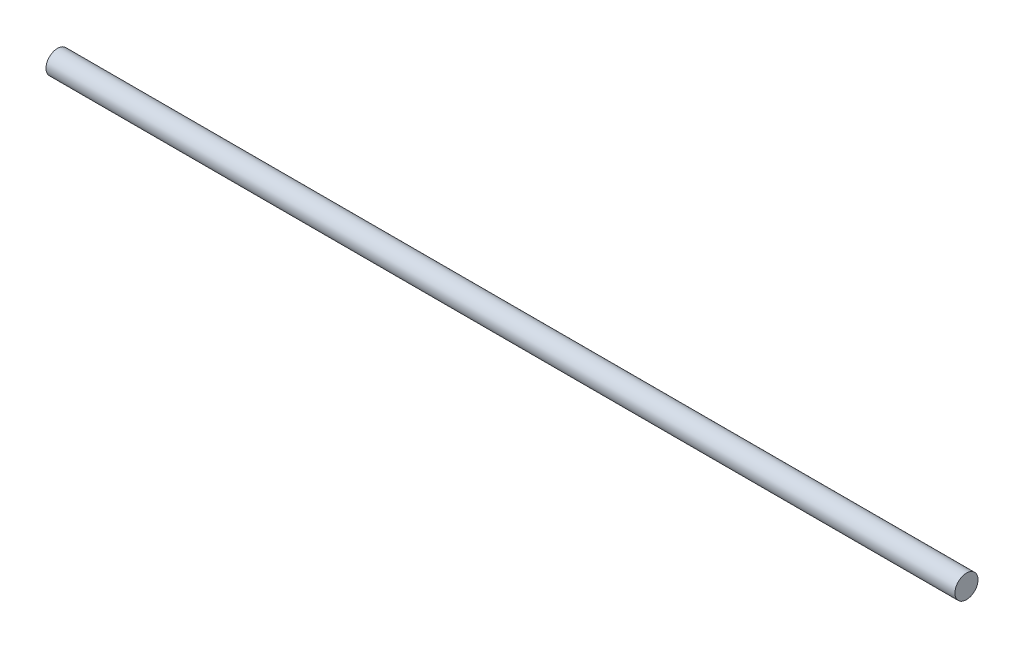
from build123d import *

# Parameters (mm, degrees)
SKETCH1_R           = 6.35
BOSS_EXTRUDE1_DEPTH = 500


with BuildPart() as part:
    # Sketch1 → Boss-Extrude1 (new body)
    with BuildSketch(Plane(origin=(0, 0, 0), x_dir=(0, 0, -1), z_dir=(1, 0, 0))):
        Circle(SKETCH1_R)
    extrude(amount=BOSS_EXTRUDE1_DEPTH)


solid = part.part
